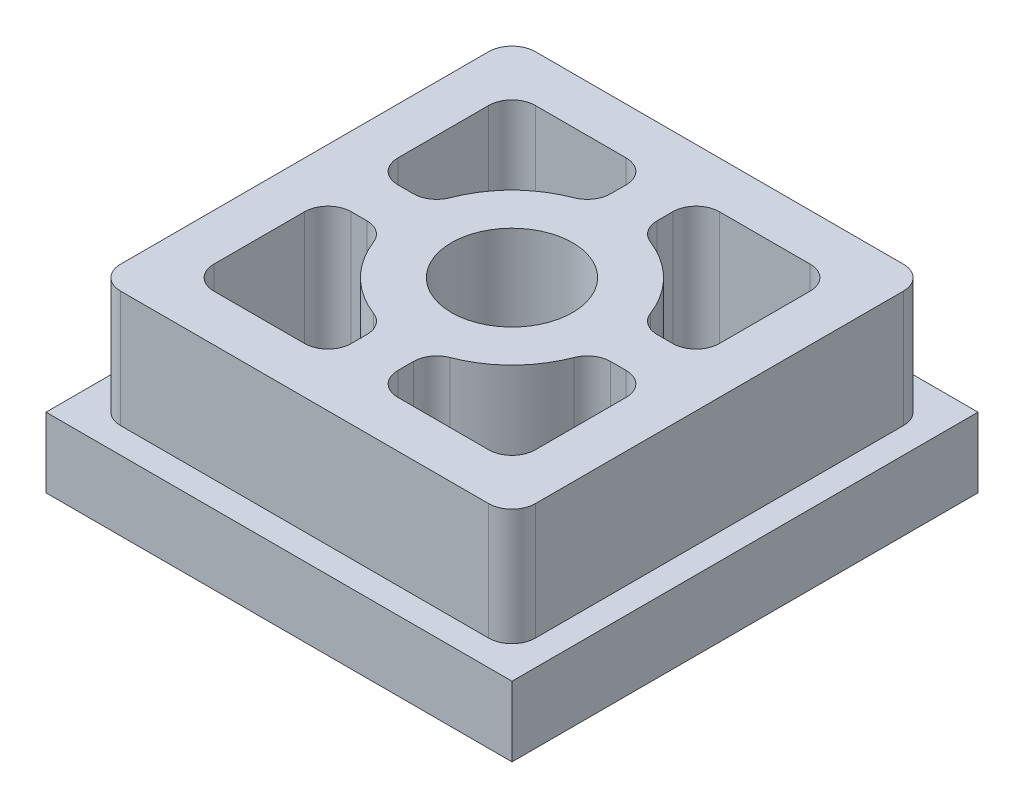
from build123d import *

# Parameters (mm, degrees)
SKETCH_1_W          = 20
SKETCH_1_H          = 20
EXTRUDE_1_DEPTH     = 3
SKETCH_2_W          = 17.8
SKETCH_2_H          = 17.8
EXTRUDE_2_DEPTH     = 5
SKETCH_3_R          = 2.6
CUT_EXTRUDE_1_DEPTH = 17.248076809
CUT_EXTRUDE_2_DEPTH = 10
FILLET_1_R          = 1
FILLET_2_R          = 1


with BuildPart() as part:
    # 草图1 → 凸台-拉伸1 (new body)
    with BuildSketch(Plane(origin=(0, 0, 0), x_dir=(1, 0, 0), z_dir=(0, 1, 0))):
        Rectangle(SKETCH_1_W, SKETCH_1_H)
    extrude(amount=EXTRUDE_1_DEPTH)

    # 草图2 → 凸台-拉伸2 (add)
    with BuildSketch(Plane(origin=(0, 3, 0), x_dir=(1, 0, 0), z_dir=(0, 1, 0))):
        Rectangle(SKETCH_2_W, SKETCH_2_H)
    extrude(amount=EXTRUDE_2_DEPTH)

    # 草图3 → 切除-拉伸1 (cut, through all)
    with BuildSketch(Plane(origin=(0, 8, 0), x_dir=(1, 0, 0), z_dir=(0, 1, 0))):
        with Locations(Location((0, 0, 0), (0, 0, 270))):
            Circle(SKETCH_3_R)
    extrude(amount=-CUT_EXTRUDE_1_DEPTH, mode=Mode.SUBTRACT)

    # 草图4 → 切除-拉伸2 (cut)
    with BuildSketch(Plane(origin=(0, 8, 0), x_dir=(1, 0, 0), z_dir=(0, 1, 0))):
        with BuildLine():
            Line((-4.489988864, -1), (-6.9, -1))
            Line((-6.9, -1), (-6.9, -6.9))
            Line((-6.9, -6.9), (-1, -6.9))
            Line((-1, -6.9), (-1, -4.489988864))
            ThreePointArc((-1, -4.489988864), (-3.252691193, -3.252691193), (-4.489988864, -1))
        make_face()
        with BuildLine():
            Line((-6.9, 6.9), (-6.9, 1))
            Line((-6.9, 1), (-4.489988864, 1))
            ThreePointArc((-4.489988864, 1), (-3.252691193, 3.252691193), (-1, 4.489988864))
            Line((-1, 4.489988864), (-1, 6.9))
            Line((-1, 6.9), (-6.9, 6.9))
        make_face()
        with BuildLine():
            ThreePointArc((4.489988864, -1), (3.252691193, -3.252691193), (1, -4.489988864))
            Line((1, -4.489988864), (1, -6.9))
            Line((1, -6.9), (6.9, -6.9))
            Line((6.9, -6.9), (6.9, -1))
            Line((6.9, -1), (4.489988864, -1))
        make_face()
        with BuildLine():
            Line((1, 6.9), (1, 4.489988864))
            ThreePointArc((1, 4.489988864), (3.252691193, 3.252691193), (4.489988864, 1))
            Line((4.489988864, 1), (6.9, 1))
            Line((6.9, 1), (6.9, 6.9))
            Line((6.9, 6.9), (1, 6.9))
        make_face()
    extrude(amount=-CUT_EXTRUDE_2_DEPTH, mode=Mode.SUBTRACT)

    # 圆角1
    fillet_1_edges = [part.edges().sort_by_distance(p)[0] for p in [
        (-1, 4, -4.489988864),
        (-4.489988864, 4, -1),
        (-6.9, 4, -1),
        (-6.9, 4, -6.9),
        (-1, 4, -6.9),
        (1, 4, 4.489988864),
        (4.489988864, 4, 1),
        (6.9, 4, 1),
        (6.9, 4, 6.9),
        (1, 4, 6.9),
        (4.489988864, 4, -1),
        (1, 4, -4.489988864),
        (1, 4, -6.9),
        (6.9, 4, -6.9),
        (6.9, 4, -1),
        (-4.489988864, 4, 1),
        (-1, 4, 4.489988864),
        (-1, 4, 6.9),
        (-6.9, 4, 6.9),
        (-6.9, 4, 1),
    ]]
    fillet(fillet_1_edges, radius=FILLET_1_R)

    # 圆角2
    fillet_2_edges = [part.edges().sort_by_distance(p)[0] for p in [
        (8.9, 5.5, 8.9),
        (8.9, 5.5, -8.9),
        (-8.9, 5.5, -8.9),
        (-8.9, 5.5, 8.9),
    ]]
    fillet(fillet_2_edges, radius=FILLET_2_R)


solid = part.part
